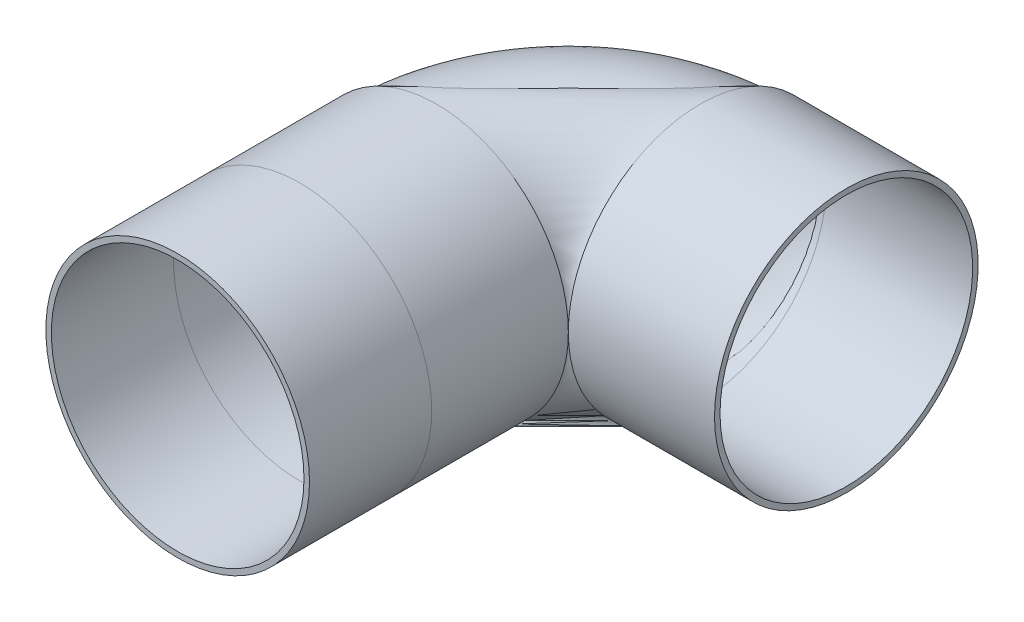
from build123d import *

# Parameters (mm, degrees)
SKETCH_3_R   = 55
SKETCH_3_R_2 = 52.7


with BuildPart() as part:
    # По траектории1: sweep along a path in Эскиз1
    with BuildLine(Plane(origin=(0, 0, 0), x_dir=(1, 0, 0), z_dir=(0, 1, 0))) as sweep_1_path:
        Line((116, 55), (55, 55))
        ThreePointArc((55, 55), (16.109127035, 38.890872965), (0, 0))
        Line((0, 0), (0, -57))
        Line((0, -57), (0, -108))
    # Эскиз3 → По траектории1 (sweep)
    with BuildSketch(Plane.XY.offset(108)):
        Circle(SKETCH_3_R)
        Circle(SKETCH_3_R_2, mode=Mode.SUBTRACT)
    sweep(path=sweep_1_path.line)


solid = part.part
